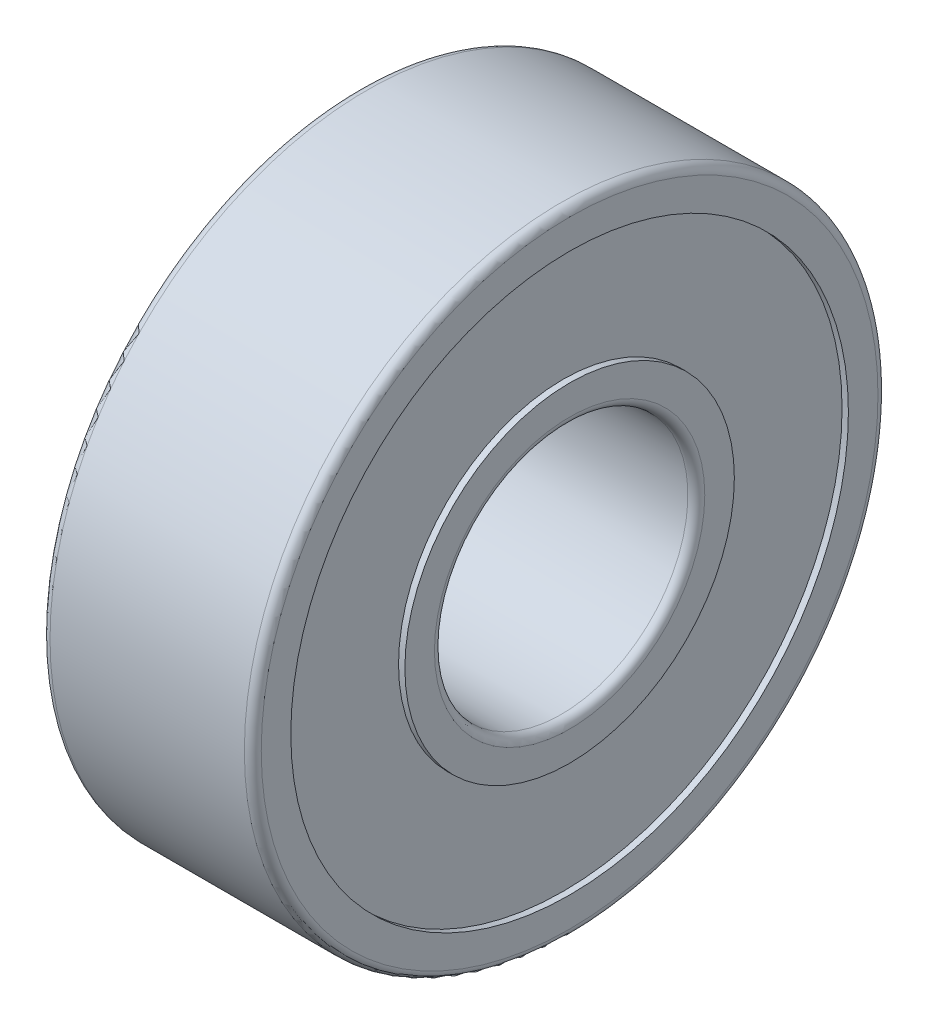
from build123d import *

# Parameters (mm, degrees)
FILLET1_R = 0.2


with BuildPart() as part:
    # Sketch1 → Revolve1 (revolve)
    with BuildSketch(Plane.XY, mode=Mode.PRIVATE) as revolve1_sk:
        Polygon((0, 3), (0, 3.9), (0.15, 3.9), (0.15, 6.6), (0, 6.6), (0, 7.5), (5, 7.5), (5, 6.6), (4.85, 6.6), (4.85, 3.9), (5, 3.9), (5, 3), align=None)
    revolve(revolve1_sk.sketch.rotate(Axis((0, 0, 0), (1, 0, 0)), 90), axis=Axis((0, 0, 0), (1, 0, 0)))

    # Fillet1
    fillet1_edges = [part.edges().sort_by_distance(p)[0] for p in [
        (5, 0, -7.5),
        (0, 0, -7.5),
        (0, 0, -3),
        (5, 0, -3),
    ]]
    fillet(fillet1_edges, radius=FILLET1_R)


solid = part.part
